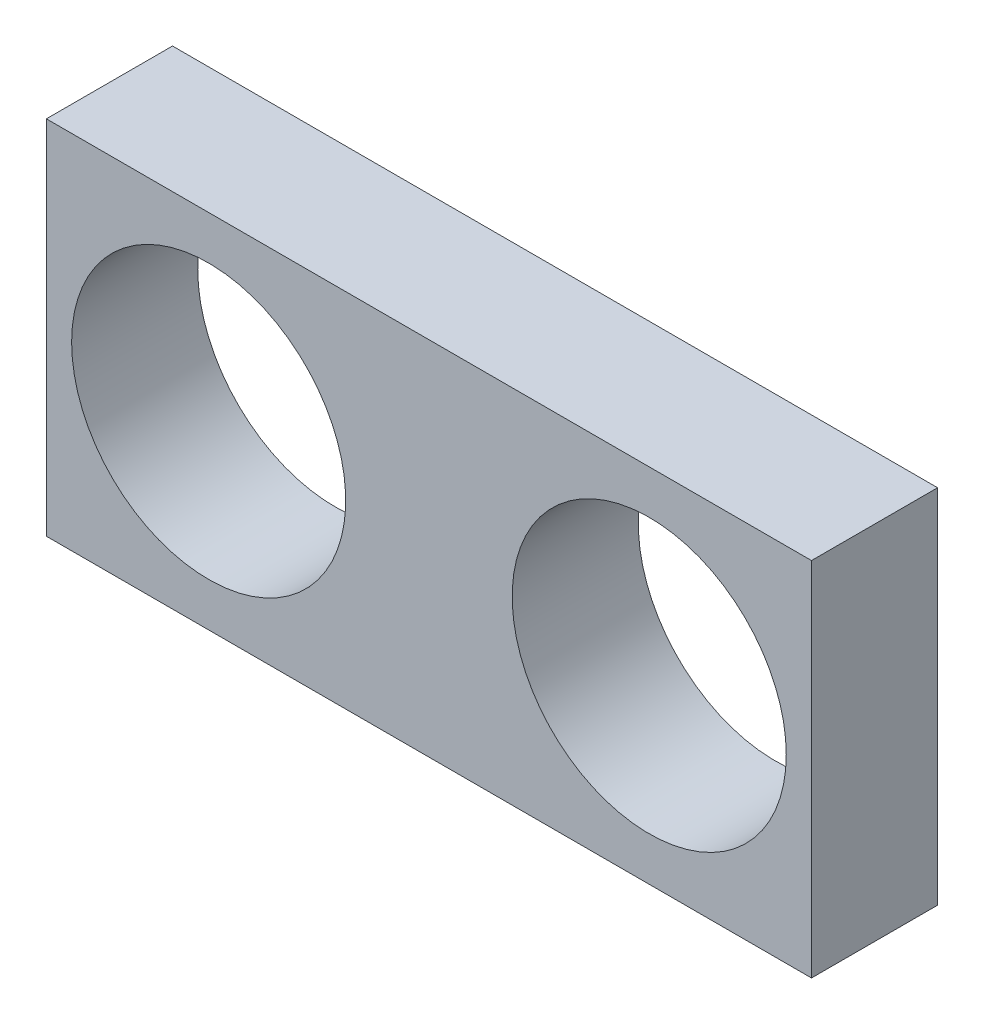
from build123d import *

# Parameters (mm, degrees)
SKETCH2_W           = 45.5
SKETCH2_H           = 21.5
SKETCH2_R           = 8.15
BOSS_EXTRUDE1_DEPTH = 7.5


with BuildPart() as part:
    # Sketch2 → Boss-Extrude1 (new body)
    with BuildSketch(Plane.XY):
        with Locations((-0.478108581, 9.888353765)):
            Rectangle(SKETCH2_W, SKETCH2_H)
        with Locations((12.621891419, 9.888353765)):
            Circle(SKETCH2_R, mode=Mode.SUBTRACT)
        with Locations((-13.578108581, 9.888353765)):
            Circle(SKETCH2_R, mode=Mode.SUBTRACT)
    extrude(amount=BOSS_EXTRUDE1_DEPTH)


solid = part.part
